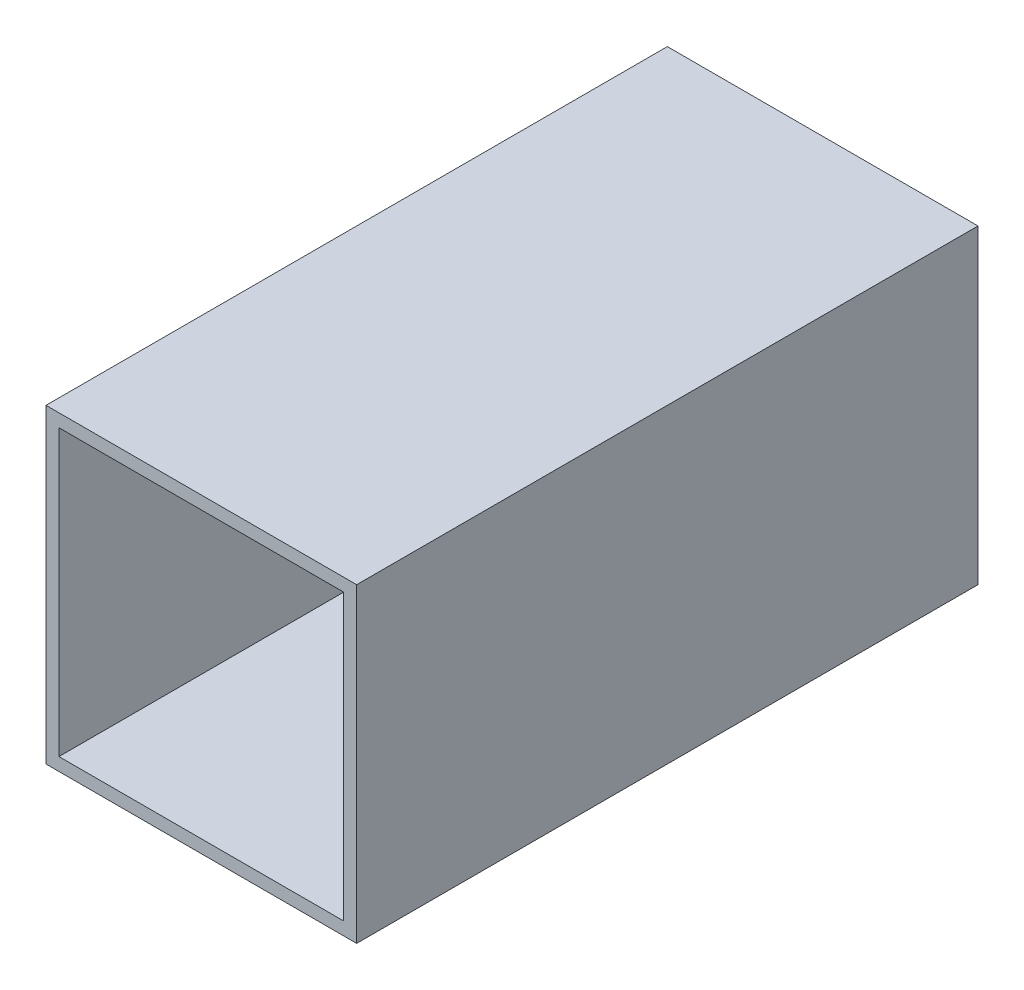
from build123d import *

# Parameters (mm, degrees)
SKETCH1_W           = 76.2
SKETCH1_H           = 76.2
SKETCH1_W_2         = 69.85
SKETCH1_H_2         = 69.85
BOSS_EXTRUDE1_DEPTH = 76.2


with BuildPart() as part:
    # Sketch1 → Boss-Extrude1 (new, symmetric)
    with BuildSketch(Plane.XY):
        Rectangle(SKETCH1_W, SKETCH1_H)
        Rectangle(SKETCH1_W_2, SKETCH1_H_2, mode=Mode.SUBTRACT)
    extrude(amount=BOSS_EXTRUDE1_DEPTH, both=True)


solid = part.part
